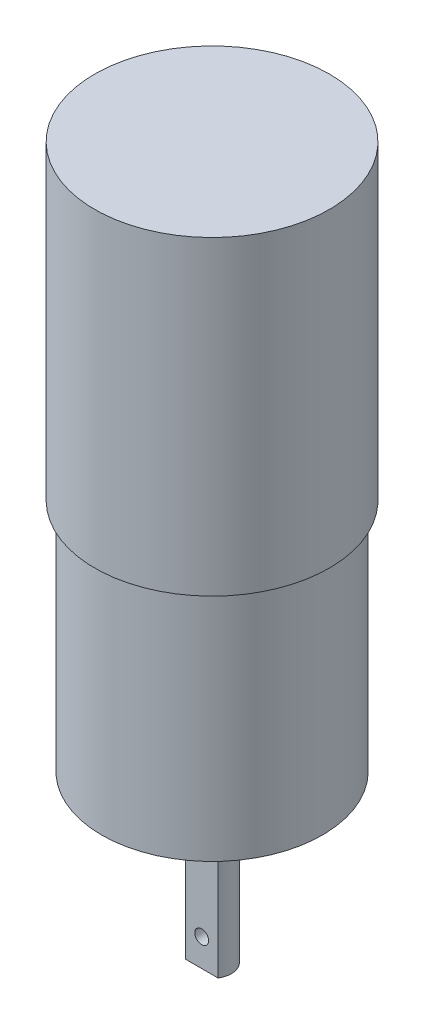
from build123d import *

# Parameters (mm, degrees)
SKETCH1_R               = 8
BOSS_EXTRUDE1_DEPTH     = 17
SKETCH2_R               = 8.5
BOSS_EXTRUDE2_DEPTH     = 22.5
SKETCH3_R               = 3
BOSS_EXTRUDE3_DEPTH     = 2
SKETCH4_R               = 1.4
BOSS_EXTRUDE4_DEPTH     = 10
CUT_EXTRUDE1_START      = -8.5
CUT_EXTRUDE1_DEPTH      = 8.5
CUT_EXTRUDE2_REACH      = 43.45
CUT_EXTRUDE2_END_RADIUS = 1.4
SKETCH6_R               = 0.5


with BuildPart() as part:
    # Sketch1 → Boss-Extrude1 (new body)
    with BuildSketch(Plane(origin=(0, 0, 0), x_dir=(1, 0, 0), z_dir=(0, 1, 0))):
        with Locations(Location((0, 0, 0), (0, 0, 270))):
            Circle(SKETCH1_R)
    extrude(amount=BOSS_EXTRUDE1_DEPTH)

    # Sketch2 → Boss-Extrude2 (add)
    with BuildSketch(Plane(origin=(0, 17, 0), x_dir=(1, 0, 0), z_dir=(0, 1, 0))):
        with Locations(Location((0, 0, 0), (0, 0, 90))):
            Circle(SKETCH2_R)
    extrude(amount=BOSS_EXTRUDE2_DEPTH)

    # Sketch3 → Boss-Extrude3 (add)
    with BuildSketch(Plane.XZ):
        with Locations(Location((0, 0, 0), (0, 0, 270))):
            Circle(SKETCH3_R)
    extrude(amount=BOSS_EXTRUDE3_DEPTH)

    # Sketch4 → Boss-Extrude4 (add)
    with BuildSketch(Plane.XZ.offset(2)):
        with Locations(Location((0, 0, 0), (0, 0, 270))):
            Circle(SKETCH4_R)
    extrude(amount=BOSS_EXTRUDE4_DEPTH)

    # Sketch5 → Cut-Extrude1 (cut)
    with BuildSketch(Plane.XZ.offset(12).offset(CUT_EXTRUDE1_START)):
        with BuildLine():
            Line((-1.182159042, 0.75), (1.182159042, 0.75))
            ThreePointArc((1.182159042, 0.75), (0, 1.4), (-1.182159042, 0.75))
        make_face()
    extrude(amount=CUT_EXTRUDE1_DEPTH, mode=Mode.SUBTRACT)

    # Cut-Extrude2: up to this cylinder (the profile starts inside it)
    cut_extrude2_end = Plane(origin=(0, -10, 0), z_dir=(0, 1, 0)) * Cylinder(CUT_EXTRUDE2_END_RADIUS, 90.7, mode=Mode.PRIVATE)
    # Sketch6 → Cut-Extrude2 (cut, up to the surface)
    with BuildSketch(Plane.XY.offset(0.75), mode=Mode.PRIVATE) as cut_extrude2_sk1:
        with Locations((0, -10)):
            Circle(SKETCH6_R)
    cut_extrude2_tool1 = extrude(cut_extrude2_sk1.sketch, amount=-CUT_EXTRUDE2_REACH, mode=Mode.PRIVATE) & cut_extrude2_end
    add(cut_extrude2_tool1.solids().sort_by_distance((0, -10, 0.75))[0], mode=Mode.SUBTRACT)


solid = part.part
